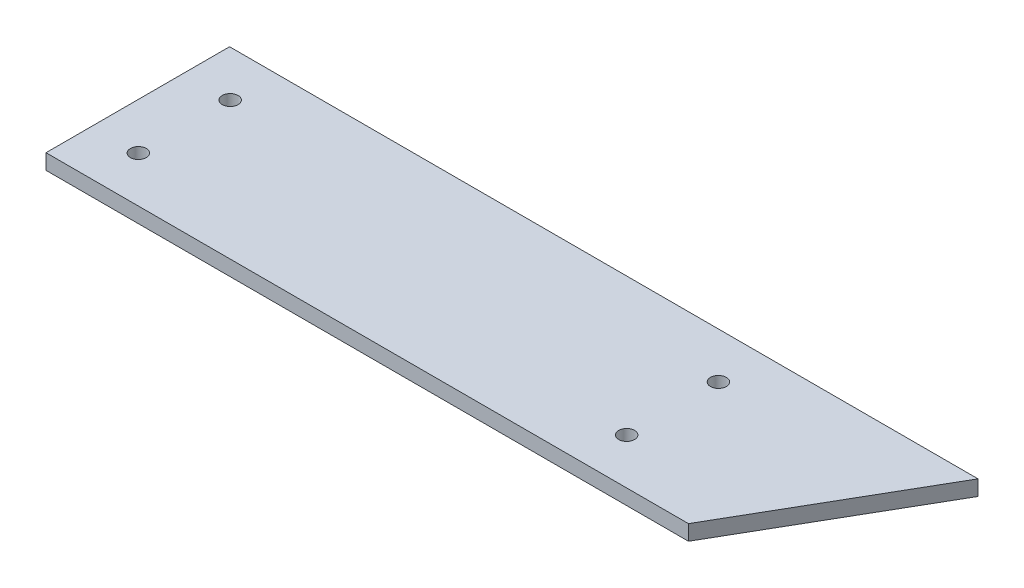
from build123d import *

# Parameters (mm, degrees)
BOSS_EXTRUDE1_DEPTH = 1.5875
SKETCH2_R           = 1.651
CUT_EXTRUDE1_DEPTH  = 3.175


with BuildPart() as part:
    # Sketch1 → Boss-Extrude1 (new, symmetric)
    with BuildSketch(Plane(origin=(0, 0, 0), x_dir=(1, 0, 0), z_dir=(0, 1, 0))):
        Polygon((66.675, 19.05), (88.672045256, 19.05), (66.675, -19.05), (-66.675, -19.05), (-66.675, 19.05), align=None)
    extrude(amount=BOSS_EXTRUDE1_DEPTH, both=True)

    # Sketch2 → Cut-Extrude1 (cut)
    with BuildSketch(Plane(origin=(0, 1.5875, 0), x_dir=(1, 0, 0), z_dir=(0, 1, 0))):
        with Locations(Location((-57.023, 9.525, 0), (0, 0, 270))):
            Circle(SKETCH2_R)
        with Locations(Location((-57.023, -9.525, 0), (0, 0, 270))):
            Circle(SKETCH2_R)
        with Locations(Location((44.323, -9.525, 0), (0, 0, 270))):
            Circle(SKETCH2_R)
        with Locations(Location((44.323, 9.525, 0), (0, 0, 270))):
            Circle(SKETCH2_R)
    extrude(amount=-CUT_EXTRUDE1_DEPTH, mode=Mode.SUBTRACT)


solid = part.part
